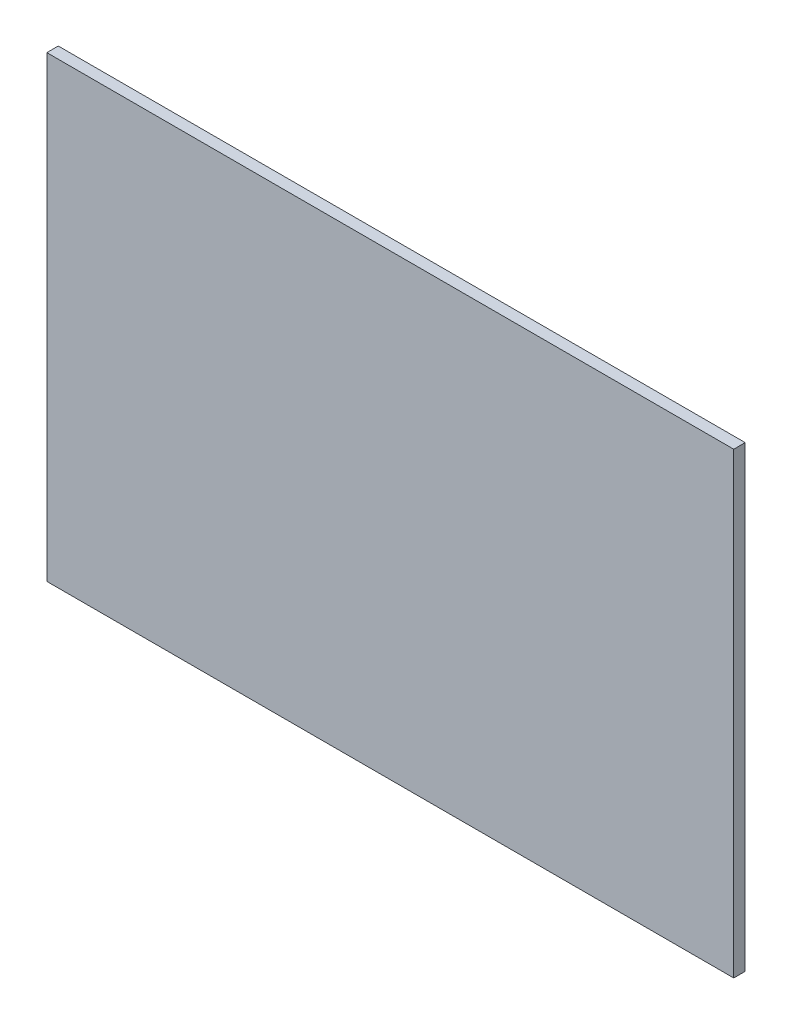
from build123d import *

# Parameters (mm, degrees)
SKETCH_1_W      = 180
SKETCH_1_H      = 120
EXTRUDE_1_DEPTH = 3


with BuildPart() as part:
    # 草图1 → 凸台-拉伸1 (new body)
    with BuildSketch(Plane.XY):
        Rectangle(SKETCH_1_W, SKETCH_1_H)
    extrude(amount=EXTRUDE_1_DEPTH)


solid = part.part
